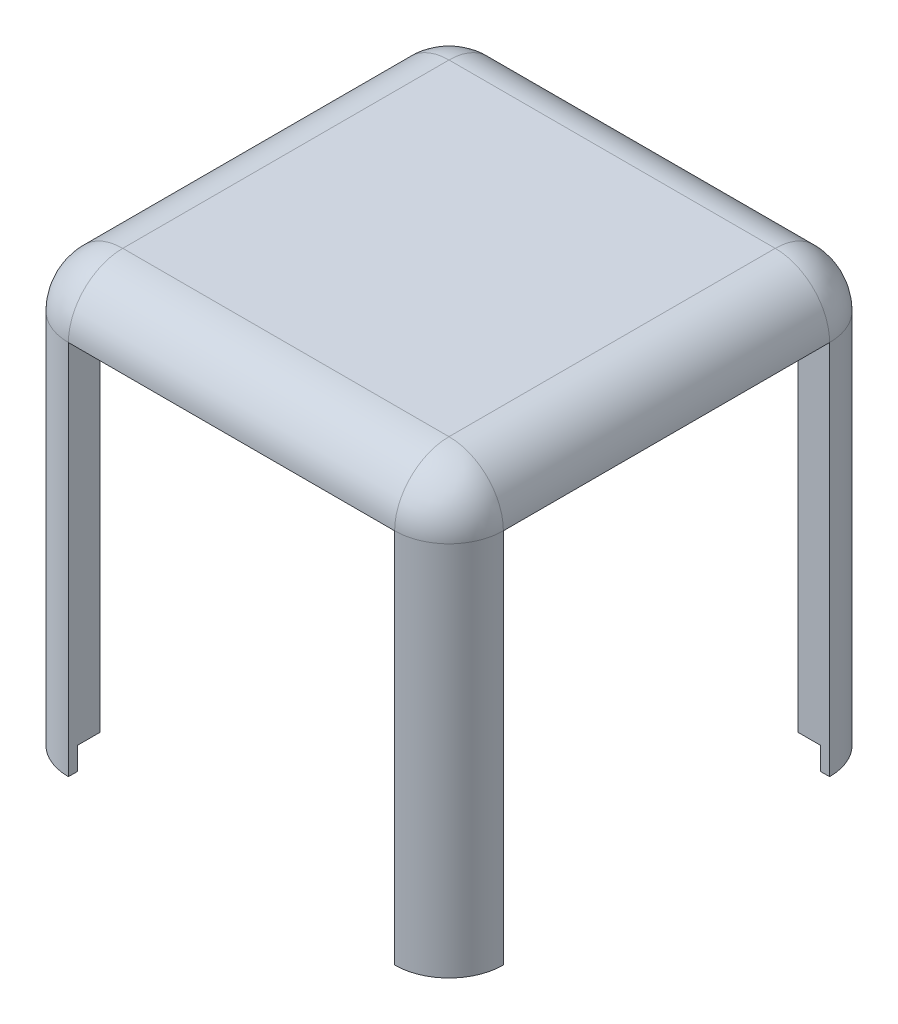
from build123d import *

# Parameters (mm, degrees)
EXTRUDE_1_DEPTH     = 51.5
FILLET_2_R          = 6
SKETCH_2_W          = 41
SKETCH_2_H          = 41
CUT_EXTRUDE_1_DEPTH = 48.5
SKETCH_3_W          = 36
SKETCH_3_H          = 45.5
CUT_EXTRUDE_2_DEPTH = 54
SKETCH_4_W          = 36
SKETCH_4_H          = 45.5
CUT_EXTRUDE_3_DEPTH = 54
CUT_EXTRUDE_4_DEPTH = 6.5
CUT_EXTRUDE_5_DEPTH = 4


with BuildPart() as part:
    # 草图1 → 凸台-拉伸1 (new body)
    with BuildSketch(Plane(origin=(0, 0, 0), x_dir=(1, 0, 0), z_dir=(0, 1, 0))):
        with BuildLine():
            Line((-18, -24), (18, -24))
            ThreePointArc((18, -24), (22.242640687, -22.242640687), (24, -18))
            Line((24, -18), (24, 18))
            ThreePointArc((24, 18), (22.242640687, 22.242640687), (18, 24))
            Line((18, 24), (-18, 24))
            ThreePointArc((-18, 24), (-22.242640687, 22.242640687), (-24, 18))
            Line((-24, 18), (-24, -18))
            ThreePointArc((-24, -18), (-22.242640687, -22.242640687), (-18, -24))
        make_face()
    extrude(amount=EXTRUDE_1_DEPTH)

    # 圆角2
    fillet_2_edges = [part.edges().sort_by_distance(p)[0] for p in [
        (22.242640687, 51.5, -22.242640687),
        (24, 51.5, 0),
        (22.242640687, 51.5, 22.242640687),
        (0, 51.5, 24),
        (-22.242640687, 51.5, 22.242640687),
        (-24, 51.5, 0),
        (-22.242640687, 51.5, -22.242640687),
        (0, 51.5, -24),
    ]]
    fillet(fillet_2_edges, radius=FILLET_2_R)

    # 草图2 → 切除-拉伸1 (cut)
    with BuildSketch(Plane.XZ):
        Rectangle(SKETCH_2_W, SKETCH_2_H)
    extrude(amount=-CUT_EXTRUDE_1_DEPTH, mode=Mode.SUBTRACT)

    # 草图3 → 切除-拉伸2 (cut)
    with BuildSketch(Plane(origin=(0, 0, -24), x_dir=(-1, 0, 0), z_dir=(0, 0, -1))):
        with Locations((0, 22.75)):
            Rectangle(SKETCH_3_W, SKETCH_3_H)
    extrude(amount=-CUT_EXTRUDE_2_DEPTH, mode=Mode.SUBTRACT)

    # 草图4 → 切除-拉伸3 (cut)
    with BuildSketch(Plane.ZY.offset(24)):
        with Locations((0, 22.75)):
            Rectangle(SKETCH_4_W, SKETCH_4_H)
    extrude(amount=-CUT_EXTRUDE_3_DEPTH, mode=Mode.SUBTRACT)

    # 草图5 → 切除-拉伸4 (cut)
    with BuildSketch(Plane.XZ):
        with BuildLine():
            Line((-17.5, -23), (17.5, -23))
            ThreePointArc((17.5, -23), (21.389087297, -21.389087297), (23, -17.5))
            Line((23, -17.5), (23, 17.5))
            ThreePointArc((23, 17.5), (21.389087297, 21.389087297), (17.5, 23))
            Line((17.5, 23), (-17.5, 23))
            ThreePointArc((-17.5, 23), (-21.389087297, 21.389087297), (-23, 17.5))
            Line((-23, 17.5), (-23, -17.5))
            ThreePointArc((-23, -17.5), (-21.389087297, -21.389087297), (-17.5, -23))
        make_face()
    extrude(amount=-CUT_EXTRUDE_4_DEPTH, mode=Mode.SUBTRACT)

    # 草图8 → 切除-拉伸5 (cut)
    with BuildSketch(Plane.XZ):
        with BuildLine():
            Line((18, -22.977225575), (18, -24))
            ThreePointArc((18, -24), (22.242640687, -22.242640687), (24, -18))
            Line((24, -18), (22.977225575, -18))
            ThreePointArc((22.977225575, -18), (21.389087297, -21.389087297), (18, -22.977225575))
        make_face()
        with BuildLine():
            Line((22.977225575, 18), (24, 18))
            ThreePointArc((24, 18), (22.242640687, 22.242640687), (18, 24))
            Line((18, 24), (18, 22.977225575))
            ThreePointArc((18, 22.977225575), (21.389087297, 21.389087297), (22.977225575, 18))
        make_face()
        with BuildLine():
            Line((-18, 22.977225575), (-18, 24))
            ThreePointArc((-18, 24), (-22.242640687, 22.242640687), (-24, 18))
            Line((-24, 18), (-22.977225575, 18))
            ThreePointArc((-22.977225575, 18), (-21.389087297, 21.389087297), (-18, 22.977225575))
        make_face()
        with BuildLine():
            Line((-22.977225575, -18), (-24, -18))
            ThreePointArc((-24, -18), (-22.242640687, -22.242640687), (-18, -24))
            Line((-18, -24), (-18, -22.977225575))
            ThreePointArc((-18, -22.977225575), (-21.389087297, -21.389087297), (-22.977225575, -18))
        make_face()
    extrude(amount=-CUT_EXTRUDE_5_DEPTH, mode=Mode.SUBTRACT)


solid = part.part
